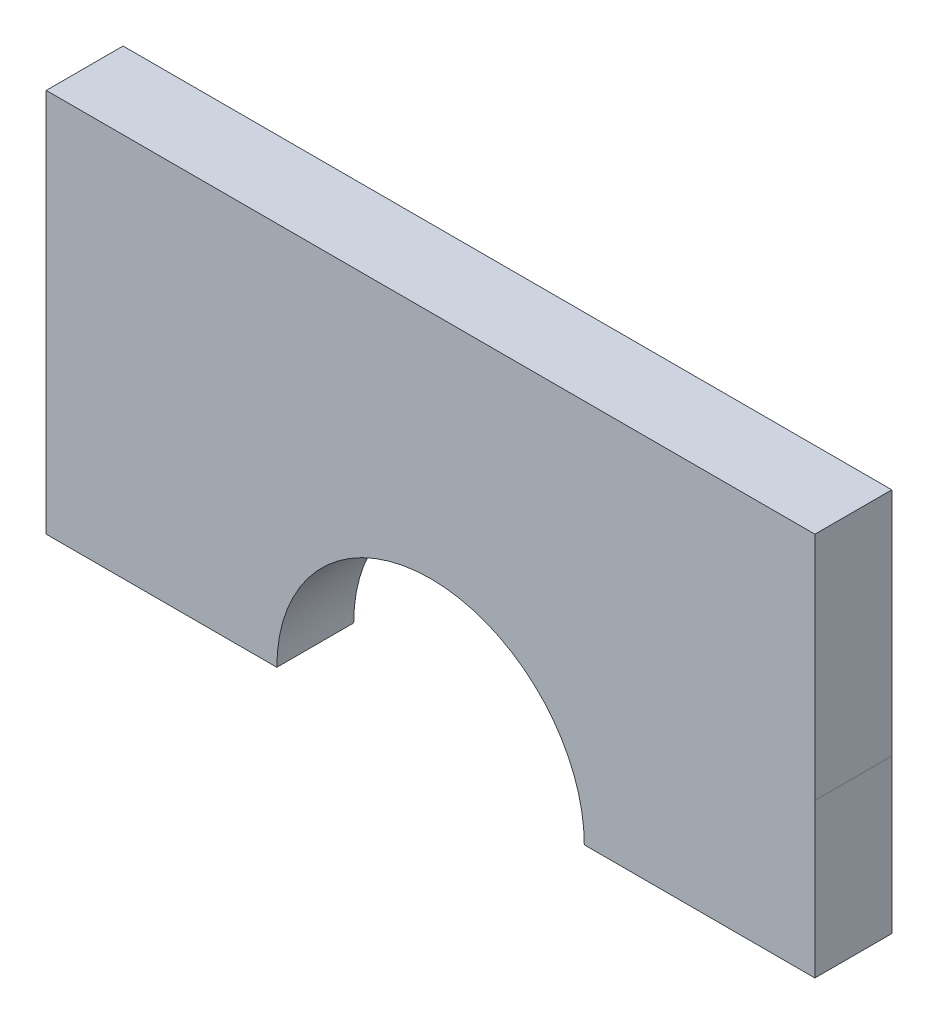
from build123d import *

# Parameters (mm, degrees)
SKETCH1_W           = 100
SKETCH1_H           = 50
BOSS_EXTRUDE1_DEPTH = 10
SKETCH3_R           = 20
CUT_EXTRUDE1_DEPTH  = 113.249721603


with BuildPart() as part:
    # Sketch1 → Boss-Extrude1 (new body)
    with BuildSketch(Plane.XY):
        with Locations((50, 25)):
            Rectangle(SKETCH1_W, SKETCH1_H)
    extrude(amount=BOSS_EXTRUDE1_DEPTH)

    # Sketch3 → Cut-Extrude1 (cut, through all)
    with BuildSketch(Plane.XY.offset(10)):
        with Locations((50, 0)):
            Circle(SKETCH3_R)
    extrude(amount=-CUT_EXTRUDE1_DEPTH, mode=Mode.SUBTRACT)


solid = part.part
